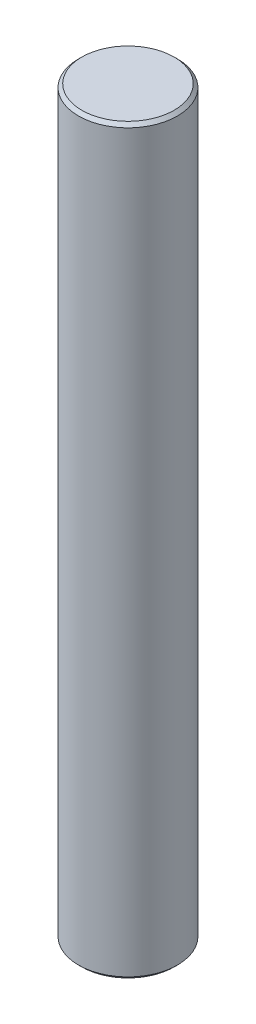
from build123d import *

# Parameters (mm, degrees)
SKETCH1_W     = 3
SKETCH1_H     = 45
CHAMFER1_SIZE = 0.2


with BuildPart() as part:
    # Sketch1 → Revolve1 (revolve)
    with BuildSketch(Plane.XY, mode=Mode.PRIVATE) as revolve1_sk:
        with Locations((1.5, 0)):
            Rectangle(SKETCH1_W, SKETCH1_H)
    revolve(revolve1_sk.sketch.rotate(Axis((0, 72.708591065, 0), (0, -1, 0)), 90), axis=Axis((0, 72.708591065, 0), (0, -1, 0)))

    # Chamfer1
    chamfer1_edges = [part.edges().sort_by_distance(p)[0] for p in [
        (0, 22.5, -3),
        (0, -22.5, -3),
    ]]
    chamfer(chamfer1_edges, length=CHAMFER1_SIZE)


solid = part.part
